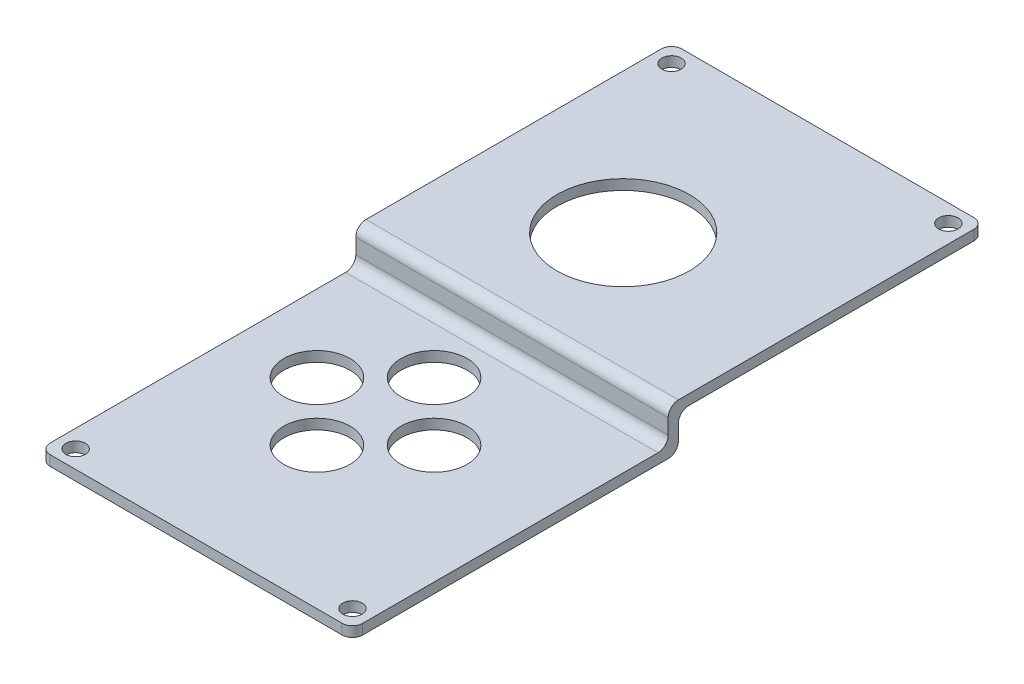
from build123d import *

# Parameters (mm, degrees)
BOSS_EXTRUDE1_DEPTH = 61.34
SKETCH3_R           = 13
SKETCH3_R_2         = 1.9
CUT_EXTRUDE1_DEPTH  = 90.104408421
SKETCH4_R           = 6.5
SKETCH4_R_2         = 1.9
CUT_EXTRUDE2_DEPTH  = 89.924662496
FILLET1_R           = 2
FILLET3_R           = 2


with BuildPart() as part:
    # Sketch2 → Boss-Extrude1 (new body)
    with BuildSketch(Plane(origin=(0, 0, 0), x_dir=(0, 0, -1), z_dir=(1, 0, 0))):
        Polygon((0, 0), (60, 0), (60, 2), (-2, 2), (-2, -5), (-64, -5), (-64, -7), (0, -7), align=None)
    extrude(amount=BOSS_EXTRUDE1_DEPTH)

    # Sketch3 → Cut-Extrude1 (cut, through all)
    with BuildSketch(Plane(origin=(0, 2, 0), x_dir=(1, 0, 0), z_dir=(0, 1, 0))):
        with Locations(Location((27.5, 23, 0), (0, 0, 270))):
            Circle(SKETCH3_R)
        with Locations(Location((57.84, 56.5, 0), (0, 0, 270))):
            Circle(SKETCH3_R_2)
        with Locations(Location((3.5, 56.5, 0), (0, 0, 270))):
            Circle(SKETCH3_R_2)
    extrude(amount=-CUT_EXTRUDE1_DEPTH, mode=Mode.SUBTRACT)

    # Sketch4 → Cut-Extrude2 (cut, through all)
    with BuildSketch(Plane(origin=(0, -5, 0), x_dir=(1, 0, 0), z_dir=(0, 1, 0))):
        with Locations(Location((38.07, -24.7, 0), (0, 0, 270))):
            Circle(SKETCH4_R)
        with Locations(Location((26.57, -36.2, 0), (0, 0, 270))):
            Circle(SKETCH4_R)
        with Locations(Location((15.07, -24.7, 0), (0, 0, 270))):
            Circle(SKETCH4_R)
        with Locations(Location((26.57, -13.2, 0), (0, 0, 270))):
            Circle(SKETCH4_R)
        with Locations(Location((57.84, -60.5, 0), (0, 0, 270))):
            Circle(SKETCH4_R_2)
        with Locations(Location((3.5, -60.5, 0), (0, 0, 270))):
            Circle(SKETCH4_R_2)
    extrude(amount=-CUT_EXTRUDE2_DEPTH, mode=Mode.SUBTRACT)

    # Fillet1
    fillet1_edges = [part.edges().sort_by_distance(p)[0] for p in [
        (30.67, -7, 0),
        (30.67, -5, 2),
        (30.67, 2, 2),
        (30.67, 0, 0),
    ]]
    fillet(fillet1_edges, radius=FILLET1_R)

    # Fillet3
    fillet3_edges = [part.edges().sort_by_distance(p)[0] for p in [
        (0, 1, -60),
        (61.34, 1, -60),
        (61.34, -6, 64),
        (0, -6, 64),
    ]]
    fillet(fillet3_edges, radius=FILLET3_R)


solid = part.part
